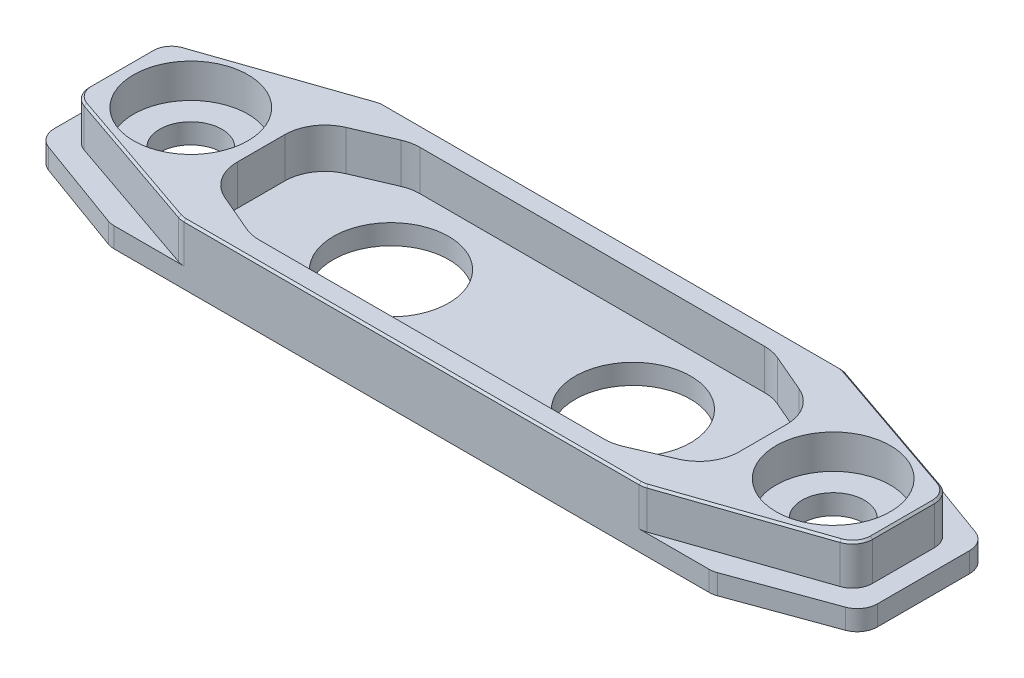
from build123d import *

# Parameters (mm, degrees)
BOSS_EXTRUDE1_DEPTH     = 1
BOSS_EXTRUDE2_DEPTH     = 2
SKETCH3_R               = 1.55
CUT_EXTRUDE1_DEPTH      = 22.313141486
CUT_EXTRUDE2_DEPTH      = 2
CUT_EXTRUDE2_DEPTH_BACK = 1.7
SKETCH4_R               = 2.85
CUT_EXTRUDE3_DEPTH      = 2
SKETCH6_R               = 2.875
CUT_EXTRUDE4_DEPTH      = 22.195518394
CHAMFER1_SIZE           = 0.1
SKETCH7_R               = 4
CUT_EXTRUDE5_DEPTH      = 0.3


with BuildPart() as part:
    # Sketch1 → Boss-Extrude1 (new body)
    with BuildSketch(Plane(origin=(0, 0, 0), x_dir=(1, 0, 0), z_dir=(0, 1, 0))):
        with BuildLine():
            Line((14.823825022, -5), (-14.823825022, -5))
            ThreePointArc((-14.823825022, -5), (-14.997328014, -4.984833342), (-15.165568085, -4.939793423))
            Line((-15.165568085, -4.939793423), (-19.841743063, -3.239366159))
            ThreePointArc((-19.841743063, -3.239366159), (-20.319067477, -2.873269928), (-20.5, -2.299572735))
            Line((-20.5, -2.299572735), (-20.5, 2.299572735))
            ThreePointArc((-20.5, 2.299572735), (-20.319067477, 2.873269928), (-19.841743063, 3.239366159))
            Line((-19.841743063, 3.239366159), (-15.165568085, 4.939793423))
            ThreePointArc((-15.165568085, 4.939793423), (-14.997328014, 4.984833342), (-14.823825022, 5))
            Line((-14.823825022, 5), (14.823825022, 5))
            ThreePointArc((14.823825022, 5), (14.997328014, 4.984833342), (15.165568085, 4.939793423))
            Line((15.165568085, 4.939793423), (19.841743063, 3.239366159))
            ThreePointArc((19.841743063, 3.239366159), (20.319067477, 2.873269928), (20.5, 2.299572735))
            Line((20.5, 2.299572735), (20.5, -2.299572735))
            ThreePointArc((20.5, -2.299572735), (20.319067477, -2.873269928), (19.841743063, -3.239366159))
            Line((19.841743063, -3.239366159), (15.165568085, -4.939793423))
            ThreePointArc((15.165568085, -4.939793423), (14.997328014, -4.984833342), (14.823825022, -5))
        make_face()
    extrude(amount=BOSS_EXTRUDE1_DEPTH)

    # Sketch2 → Boss-Extrude2 (add)
    with BuildSketch(Plane(origin=(0, 1, 0), x_dir=(1, 0, 0), z_dir=(0, 1, 0))):
        with BuildLine():
            Line((11.332922852, -5), (-11.332922852, -5))
            ThreePointArc((-11.332922852, -5), (-11.497715753, -4.986328191), (-11.65800262, -4.945686599))
            Line((-11.65800262, -4.945686599), (-18.825079769, -2.48200383))
            ThreePointArc((-18.825079769, -2.48200383), (-19.31396553, -2.117230404), (-19.5, -1.53631723))
            Line((-19.5, -1.53631723), (-19.5, 1.53631723))
            ThreePointArc((-19.5, 1.53631723), (-19.31396553, 2.117230404), (-18.825079769, 2.48200383))
            Line((-18.825079769, 2.48200383), (-11.65800262, 4.945686599))
            ThreePointArc((-11.65800262, 4.945686599), (-11.497715753, 4.986328191), (-11.332922852, 5))
            Line((-11.332922852, 5), (11.332922852, 5))
            ThreePointArc((11.332922852, 5), (11.497715753, 4.986328191), (11.65800262, 4.945686599))
            Line((11.65800262, 4.945686599), (18.825079769, 2.48200383))
            ThreePointArc((18.825079769, 2.48200383), (19.31396553, 2.117230404), (19.5, 1.53631723))
            Line((19.5, 1.53631723), (19.5, -1.53631723))
            ThreePointArc((19.5, -1.53631723), (19.31396553, -2.117230404), (18.825079769, -2.48200383))
            Line((18.825079769, -2.48200383), (11.65800262, -4.945686599))
            ThreePointArc((11.65800262, -4.945686599), (11.497715753, -4.986328191), (11.332922852, -5))
        make_face()
    extrude(amount=BOSS_EXTRUDE2_DEPTH)

    # Sketch3 → Cut-Extrude1 (cut, through all)
    with BuildSketch(Plane(origin=(0, 3, 0), x_dir=(1, 0, 0), z_dir=(0, 1, 0))):
        with Locations(Location((-16, 0, 0), (0, 0, 270))):
            Circle(SKETCH3_R)
        with Locations(Location((16, 0, 0), (0, 0, 270))):
            Circle(SKETCH3_R)
    extrude(amount=-CUT_EXTRUDE1_DEPTH, mode=Mode.SUBTRACT)

    # Sketch4 → Cut-Extrude2 (cut, two sides: drawn at the far end of the back side and taken through both)
    with BuildSketch(Plane(origin=(0, 3, 0), x_dir=(1, 0, 0), z_dir=(0, 1, 0)).offset(-CUT_EXTRUDE2_DEPTH_BACK)):
        with Locations(Location((-16, 0, 0), (0, 0, 270))):
            Circle(SKETCH4_R)
        with Locations(Location((16, 0, 0), (0, 0, 270))):
            Circle(SKETCH4_R)
    extrude(amount=CUT_EXTRUDE2_DEPTH + CUT_EXTRUDE2_DEPTH_BACK, mode=Mode.SUBTRACT)

    # Sketch5 → Cut-Extrude3 (cut)
    with BuildSketch(Plane(origin=(0, 3, 0), x_dir=(1, 0, 0), z_dir=(0, 1, 0))):
        with BuildLine():
            Line((8.589484596, -4), (-8.589484596, -4))
            ThreePointArc((-8.589484596, -4), (-8.991616341, -3.959155446), (-9.377323193, -3.83829006))
            Line((-9.377323193, -3.83829006), (-11.287838597, -3.019497744))
            ThreePointArc((-11.287838597, -3.019497744), (-12.169682184, -2.282189702), (-12.5, -1.181207684))
            Line((-12.5, -1.181207684), (-12.5, 1.181207684))
            ThreePointArc((-12.5, 1.181207684), (-12.169682184, 2.282189702), (-11.287838597, 3.019497744))
            Line((-11.287838597, 3.019497744), (-9.377323193, 3.83829006))
            ThreePointArc((-9.377323193, 3.83829006), (-8.991616341, 3.959155446), (-8.589484596, 4))
            Line((-8.589484596, 4), (8.589484596, 4))
            ThreePointArc((8.589484596, 4), (8.991616341, 3.959155446), (9.377323193, 3.83829006))
            Line((9.377323193, 3.83829006), (11.287838597, 3.019497744))
            ThreePointArc((11.287838597, 3.019497744), (12.169682184, 2.282189702), (12.5, 1.181207684))
            Line((12.5, 1.181207684), (12.5, -1.181207684))
            ThreePointArc((12.5, -1.181207684), (12.169682184, -2.282189702), (11.287838597, -3.019497744))
            Line((11.287838597, -3.019497744), (9.377323193, -3.83829006))
            ThreePointArc((9.377323193, -3.83829006), (8.991616341, -3.959155446), (8.589484596, -4))
        make_face()
    extrude(amount=-CUT_EXTRUDE3_DEPTH, mode=Mode.SUBTRACT)

    # Sketch6 → Cut-Extrude4 (cut, through all)
    with BuildSketch(Plane(origin=(0, 1, 0), x_dir=(1, 0, 0), z_dir=(0, 1, 0))):
        with Locations(Location((-6.025, 0, 0), (0, 0, 270))):
            Circle(SKETCH6_R)
        with Locations(Location((6.025, 0, 0), (0, 0, 270))):
            Circle(SKETCH6_R)
    extrude(amount=-CUT_EXTRUDE4_DEPTH, mode=Mode.SUBTRACT)

    # Chamfer1
    chamfer1_edges = [part.edges().sort_by_distance(p)[0] for p in [
        (-19.31396553, 3, -2.117230404),
        (-19.5, 3, 0),
        (-19.31396553, 3, 2.117230404),
        (-15.241541194, 3, 3.713845214),
        (-11.497715753, 3, 4.986328191),
        (0, 3, 5),
        (11.497715753, 3, 4.986328191),
        (15.241541194, 3, 3.713845214),
        (19.31396553, 3, 2.117230404),
        (19.5, 3, 0),
        (19.31396553, 3, -2.117230404),
        (15.241541194, 3, -3.713845214),
        (11.497715753, 3, -4.986328191),
        (0, 3, -5),
        (-11.497715753, 3, -4.986328191),
        (-15.241541194, 3, -3.713845214),
    ]]
    chamfer(chamfer1_edges, length=CHAMFER1_SIZE)

    # Sketch7 → Cut-Extrude5 (cut)
    with BuildSketch(Plane.XZ):
        with Locations(Location((-16, 0, 0), (0, 0, 270))):
            Circle(SKETCH7_R)
        with Locations(Location((16, 0, 0), (0, 0, 270))):
            Circle(SKETCH7_R)
    extrude(amount=-CUT_EXTRUDE5_DEPTH, mode=Mode.SUBTRACT)


solid = part.part
